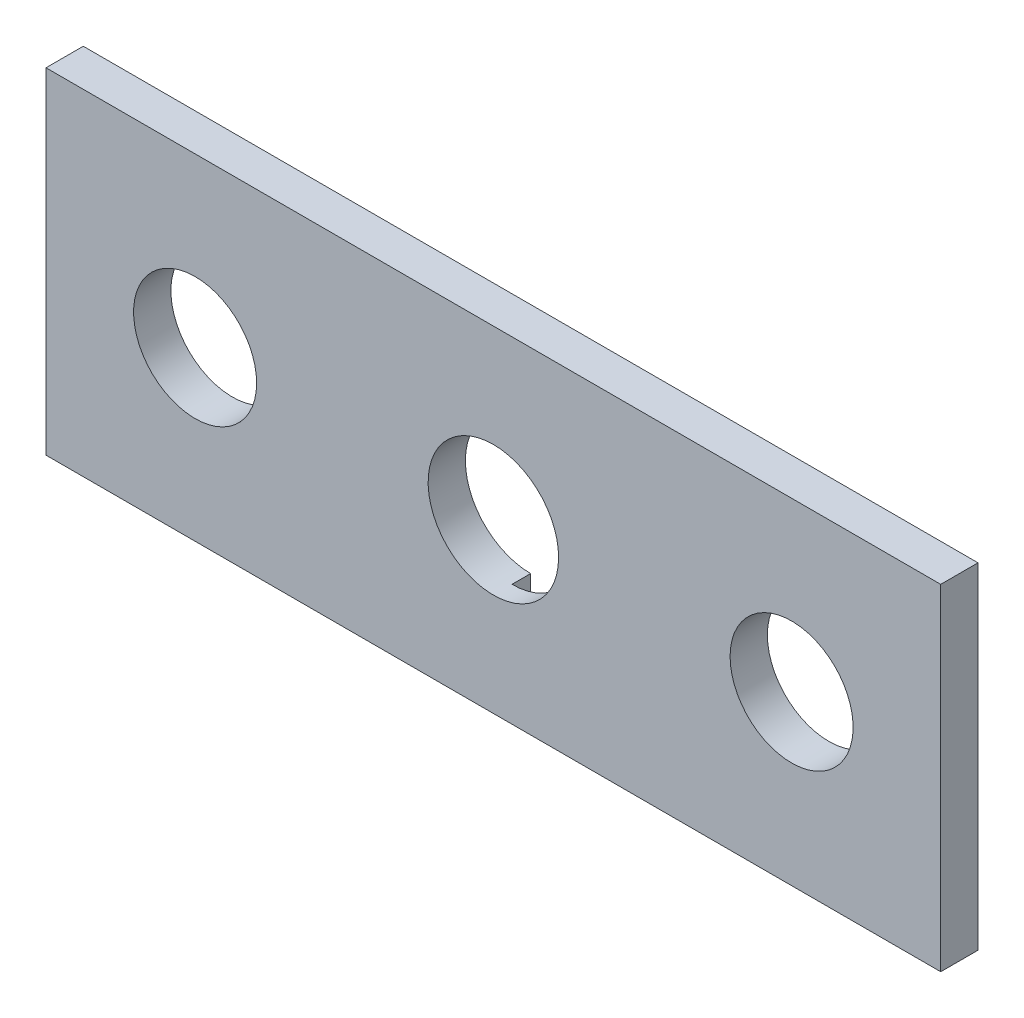
from build123d import *

# Parameters (mm, degrees)
CROQUIS1_W              = 240
CROQUIS1_H              = 90
CROQUIS1_R              = 17.5
CROQUIS1_R_2            = 16.5
SALIENTE_EXTRUIR1_DEPTH = 10
CORTAR_EXTRUIR1_DEPTH   = 5


with BuildPart() as part:
    # Croquis1 → Saliente-Extruir1 (new body)
    with BuildSketch(Plane.XY):
        with Locations((120, 45)):
            Rectangle(CROQUIS1_W, CROQUIS1_H)
        with Locations((120, 45)):
            Circle(CROQUIS1_R, mode=Mode.SUBTRACT)
        with Locations((40, 45)):
            Circle(CROQUIS1_R_2, mode=Mode.SUBTRACT)
        with Locations(Location((200, 45, 0), (0, 0, 180))):
            Circle(CROQUIS1_R_2, mode=Mode.SUBTRACT)
    extrude(amount=SALIENTE_EXTRUIR1_DEPTH)

    # Croquis2 → Cortar-Extruir1 (cut)
    with BuildSketch(Plane(origin=(0, 0, 0), x_dir=(-1, 0, 0), z_dir=(0, 0, -1))):
        with BuildLine():
            Line((-120, 62.5), (-120, 67.5))
            Line((-120, 67.5), (-165, 67.5))
            Line((-165, 67.5), (-165, 22.5))
            Line((-165, 22.5), (-120, 22.5))
            Line((-120, 22.5), (-120, 27.5))
            ThreePointArc((-120, 27.5), (-137.5, 45), (-120, 62.5))
        make_face()
    extrude(amount=-CORTAR_EXTRUIR1_DEPTH, mode=Mode.SUBTRACT)


solid = part.part
